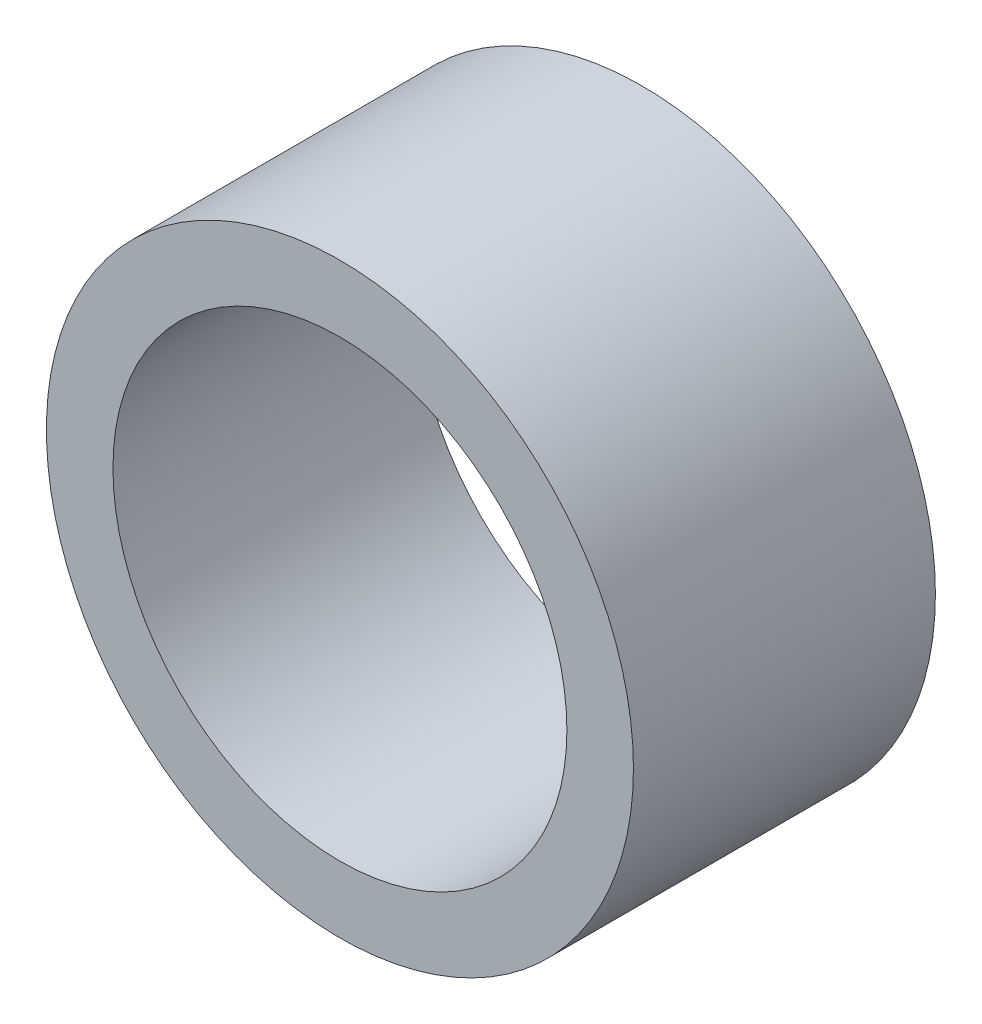
from build123d import *

# Parameters (mm, degrees)
SKETCH1_R           = 9.525
SKETCH1_R_2         = 7.366
BOSS_EXTRUDE1_DEPTH = 4.89987844


with BuildPart() as part:
    # Sketch1 → Boss-Extrude1 (new, symmetric)
    with BuildSketch(Plane.XY):
        Circle(SKETCH1_R)
        Circle(SKETCH1_R_2, mode=Mode.SUBTRACT)
    extrude(amount=BOSS_EXTRUDE1_DEPTH, both=True)


solid = part.part
